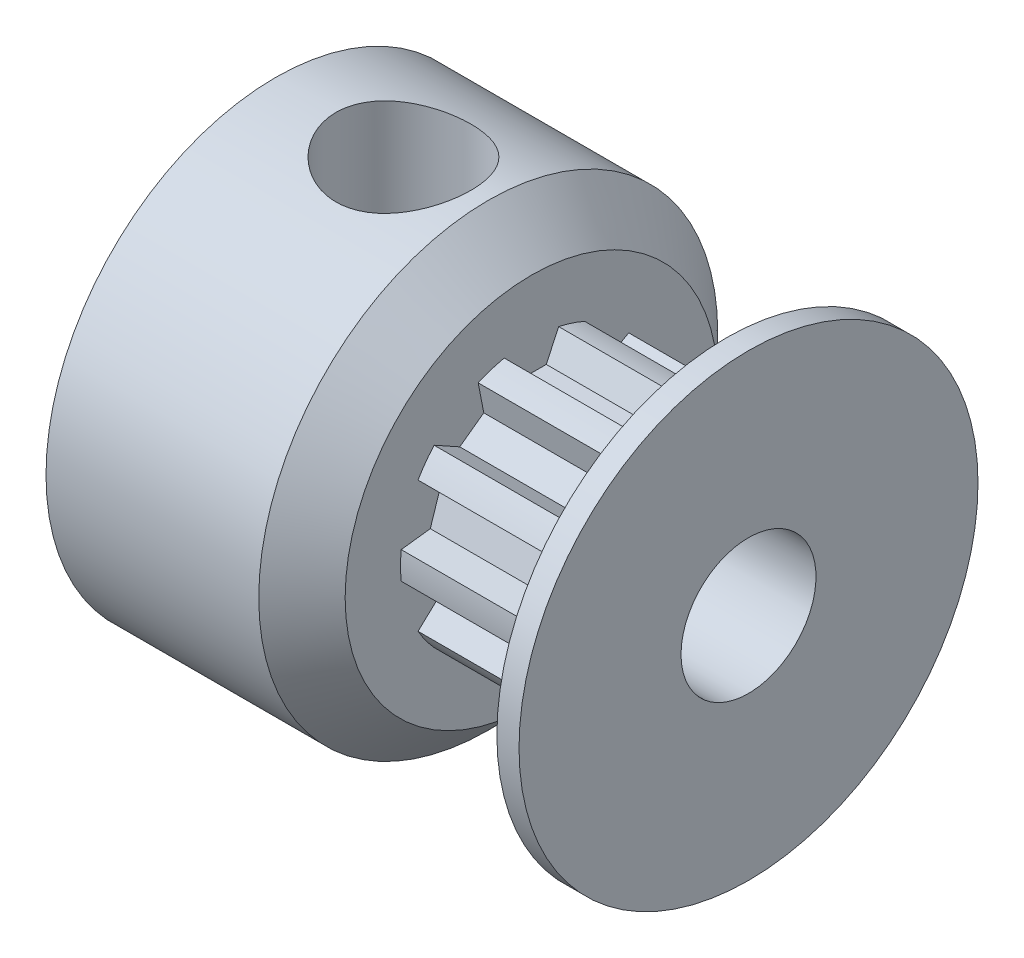
from build123d import *

# Parameters (mm, degrees)
SKETCH4_R          = 3.2385
SKETCH4_R_2        = 3.07975
CUT_EXTRUDE2_DEPTH = 4.064
CUT_EXTRUDE1_DEPTH = 4.064
CIRPATTERN1_COUNT  = 10
SKETCH6_R          = 1.5875
CUT_EXTRUDE3_DEPTH = 10.4450268


with BuildPart() as part:
    # Sketch1 → Revolve1 (revolve)
    with BuildSketch(Plane.XY, mode=Mode.PRIVATE) as revolve1_sk:
        with BuildLine():
            Line((-5.5626, 1.5875), (5.5626, 1.5875))
            Line((5.5626, 1.5875), (5.5626, 5.3975))
            Line((5.5626, 5.3975), (5.0419, 5.3975))
            ThreePointArc((5.0419, 5.3975), (4.654699632, 4.645356921), (4.5212, 3.81))
            Line((4.5212, 3.81), (4.5212, 3.2385))
            Line((4.5212, 3.2385), (0.4572, 3.2385))
            Line((0.4572, 3.2385), (0.4572, 4.3815))
            Line((0.4572, 4.3815), (-0.5588, 5.3975))
            Line((-0.5588, 5.3975), (-5.5626, 5.3975))
            Line((-5.5626, 5.3975), (-5.5626, 1.5875))
        make_face()
    revolve(revolve1_sk.sketch.rotate(Axis((-5.5626, 0, 0), (1, 0, 0)), 90), axis=Axis((-5.5626, 0, 0), (1, 0, 0)))

    # Sketch4 → Cut-Extrude2 (cut)
    with BuildSketch(Plane(origin=(0.4572, 0, 0), x_dir=(0, 0, -1), z_dir=(1, 0, 0))):
        Circle(SKETCH4_R)
        Circle(SKETCH4_R_2, mode=Mode.SUBTRACT)
    extrude(amount=CUT_EXTRUDE2_DEPTH, mode=Mode.SUBTRACT)

    # Sketch3 → Cut-Extrude1 (cut)
    with BuildSketch(Plane(origin=(0.4572, 0, 0), x_dir=(0, 0, -1), z_dir=(1, 0, 0))):
        with BuildLine():
            Line((-0.640454656, 3.012420604), (-0.349102168, 2.387613176))
            Line((-0.349102168, 2.387613176), (0.349102168, 2.387613176))
            Line((0.349102168, 2.387613176), (0.640454656, 3.012420604))
            ThreePointArc((0.640454656, 3.012420604), (0, 3.07975), (-0.640454656, 3.012420604))
        make_face()
    cut_extrude1 = extrude(amount=CUT_EXTRUDE1_DEPTH, mode=Mode.SUBTRACT)

    # CirPattern1: Cut-Extrude1 ×10 about axis
    cirpattern1_axis = Axis((0, 0, 0), (1, 0, 0))
    for i in range(1, CIRPATTERN1_COUNT):
        add(cut_extrude1.rotate(cirpattern1_axis, i * 360 / CIRPATTERN1_COUNT), mode=Mode.SUBTRACT)

    # Sketch6 → Cut-Extrude3 (cut, through all)
    with BuildSketch(Plane(origin=(0, 0, 0), x_dir=(1, 0, 0), z_dir=(0, 1, 0))):
        with Locations(Location((-2.5527, 0, 0), (0, 0, 90))):
            Circle(SKETCH6_R)
    extrude(amount=CUT_EXTRUDE3_DEPTH, mode=Mode.SUBTRACT)


solid = part.part
